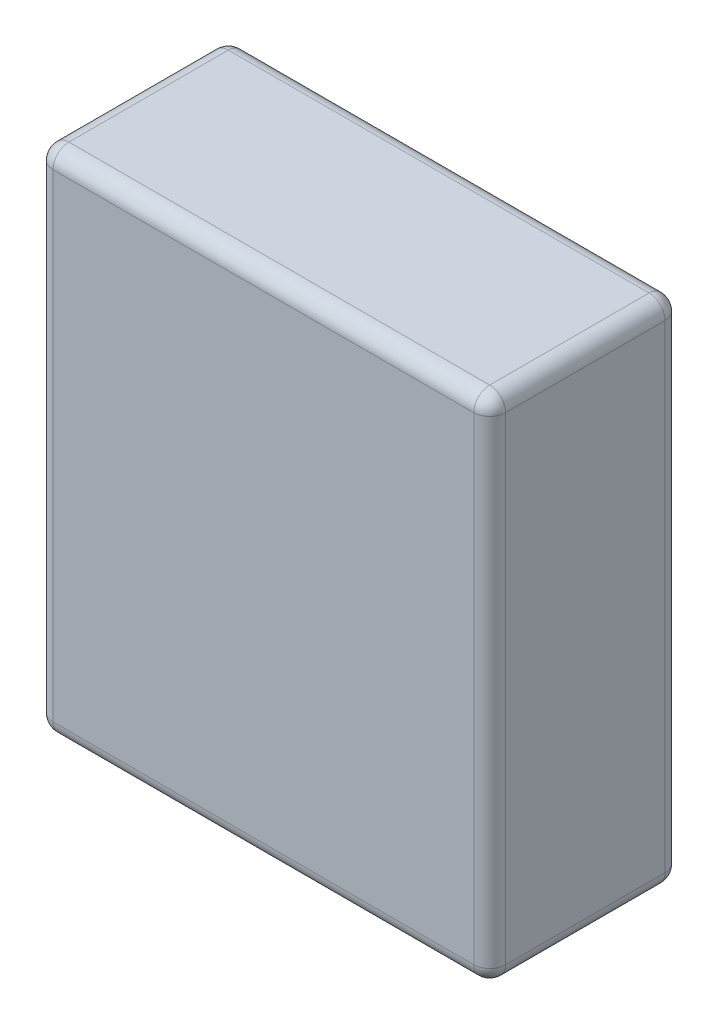
from build123d import *

# Parameters (mm, degrees)
SKETCH1_W           = 142
SKETCH1_H           = 60
BOSS_EXTRUDE1_DEPTH = 160
FILLET1_R           = 5


with BuildPart() as part:
    # Sketch1 → Boss-Extrude1 (new body)
    with BuildSketch(Plane(origin=(0, 0, 0), x_dir=(1, 0, 0), z_dir=(0, 1, 0))):
        Rectangle(SKETCH1_W, SKETCH1_H)
    extrude(amount=BOSS_EXTRUDE1_DEPTH)

    # Fillet1
    fillet1_edges = [part.edges().sort_by_distance(p)[0] for p in [
        (71, 160, 0),
        (0, 160, -30),
        (-71, 160, 0),
        (0, 0, -30),
        (71, 0, 0),
        (0, 0, 30),
        (-71, 0, 0),
        (0, 160, 30),
        (-71, 80, -30),
        (71, 80, -30),
        (71, 80, 30),
        (-71, 80, 30),
    ]]
    fillet(fillet1_edges, radius=FILLET1_R)


solid = part.part
